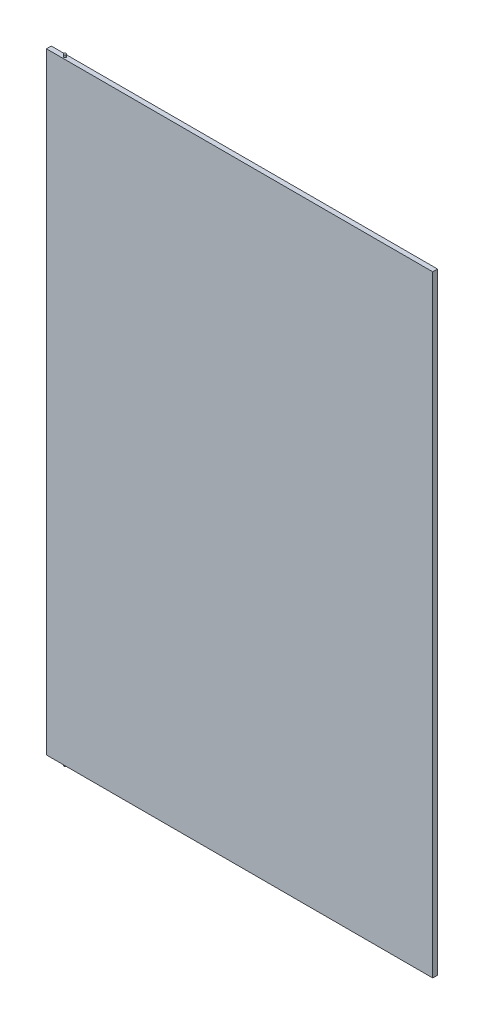
from build123d import *

# Parameters (mm, degrees)
CROQUIS1_W              = 240
CROQUIS1_H              = 380
SALIENTE_EXTRUIR1_DEPTH = 3
CROQUIS8_R              = 0.75
SALIENTE_EXTRUIR4_DEPTH = 1.5
CROQUIS10_R             = 0.75
SALIENTE_EXTRUIR5_DEPTH = 1.5


with BuildPart() as part:
    # Croquis1 → Saliente-Extruir1 (new body)
    with BuildSketch(Plane.XY):
        with Locations((-120, 190)):
            Rectangle(CROQUIS1_W, CROQUIS1_H)
    extrude(amount=SALIENTE_EXTRUIR1_DEPTH)

    # Croquis8 → Saliente-Extruir4 (add)
    with BuildSketch(Plane(origin=(0, 0, 0), x_dir=(-1, 0, 0), z_dir=(0, -1, 0))):
        with Locations((230, -1.435696055)):
            Circle(CROQUIS8_R)
    extrude(amount=SALIENTE_EXTRUIR4_DEPTH)

    # Croquis10 → Saliente-Extruir5 (add)
    with BuildSketch(Plane(origin=(0, 380, 0), x_dir=(1, 0, 0), z_dir=(0, 1, 0))):
        with Locations((-230, -1.5)):
            Circle(CROQUIS10_R)
    extrude(amount=SALIENTE_EXTRUIR5_DEPTH)


solid = part.part
